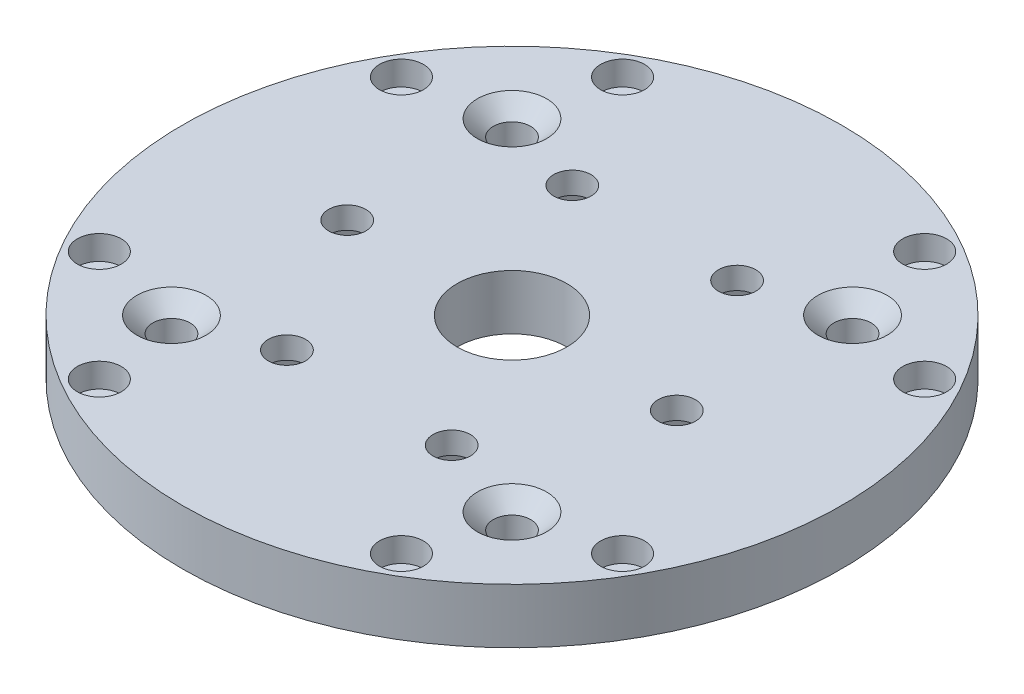
from build123d import *

# Parameters (mm, degrees)
SKETCH1_R                                       = 30
BOSS_EXTRUDE1_DEPTH                             = 5
CSK_FOR_M3_FLAT_HEAD_MACHINE_SCREW1_D           = 3.4
CSK_FOR_M3_FLAT_HEAD_MACHINE_SCREW1_CSINK_D     = 6.3
CSK_FOR_M3_FLAT_HEAD_MACHINE_SCREW1_CSINK_ANGLE = 90
CUT_EXTRUDE1_REACH                              = 44.72
SKETCH4_R                                       = 1.1
CUT_EXTRUDE2_REACH                              = 44.72
SKETCH5_R                                       = 5
SKETCH7_R                                       = 2
CUT_EXTRUDE3_DEPTH                              = 2.2
CUT_EXTRUDE4_DEPTH                              = 3
SKETCH9_R                                       = 1.7
CUT_EXTRUDE5_DEPTH                              = 43.720018727


with BuildPart() as part:
    # Sketch1 → Boss-Extrude1 (new body)
    with BuildSketch(Plane(origin=(0, 0, 0), x_dir=(1, 0, 0), z_dir=(0, 1, 0))):
        with Locations(Location((0, 0, 0), (0, 0, 270))):
            Circle(SKETCH1_R)
    extrude(amount=BOSS_EXTRUDE1_DEPTH)

    # CSK for M3 Flat Head Machine Screw1 (through all)
    with Locations(Plane(origin=(0, 5, 0), x_dir=(1, 0, 0), z_dir=(0, 1, 0))):
        with Locations((-15.5, -15.5), (15.5, 15.5), (-15.5, 15.5), (15.5, -15.5)):
            CounterSinkHole(CSK_FOR_M3_FLAT_HEAD_MACHINE_SCREW1_D / 2, CSK_FOR_M3_FLAT_HEAD_MACHINE_SCREW1_CSINK_D / 2, counter_sink_angle=CSK_FOR_M3_FLAT_HEAD_MACHINE_SCREW1_CSINK_ANGLE)

    # Sketch4 → Cut-Extrude1 (cut, up to next)
    with BuildSketch(Plane(origin=(0, 5, 0), x_dir=(1, 0, 0), z_dir=(0, 1, 0)), mode=Mode.PRIVATE) as cut_extrude1_sk1:
        with Locations(Location((-13.75, 23.815698604, 0), (0, 0, 270))):
            Circle(SKETCH4_R)
    cut_extrude1_tool1 = extrude(cut_extrude1_sk1.sketch, amount=-CUT_EXTRUDE1_REACH, mode=Mode.PRIVATE) & part.part
    # Sketch4 → Cut-Extrude1 (cut, up to next)
    with BuildSketch(Plane(origin=(0, 5, 0), x_dir=(1, 0, 0), z_dir=(0, 1, 0)), mode=Mode.PRIVATE) as cut_extrude1_sk2:
        with Locations(Location((-23.815698604, 13.75, 0), (0, 0, 270))):
            Circle(SKETCH4_R)
    cut_extrude1_tool2 = extrude(cut_extrude1_sk2.sketch, amount=-CUT_EXTRUDE1_REACH, mode=Mode.PRIVATE) & part.part
    # Sketch4 → Cut-Extrude1 (cut, up to next)
    with BuildSketch(Plane(origin=(0, 5, 0), x_dir=(1, 0, 0), z_dir=(0, 1, 0)), mode=Mode.PRIVATE) as cut_extrude1_sk3:
        with Locations(Location((13.75, 23.815698604, 0), (0, 0, 270))):
            Circle(SKETCH4_R)
    cut_extrude1_tool3 = extrude(cut_extrude1_sk3.sketch, amount=-CUT_EXTRUDE1_REACH, mode=Mode.PRIVATE) & part.part
    # Sketch4 → Cut-Extrude1 (cut, up to next)
    with BuildSketch(Plane(origin=(0, 5, 0), x_dir=(1, 0, 0), z_dir=(0, 1, 0)), mode=Mode.PRIVATE) as cut_extrude1_sk4:
        with Locations(Location((23.815698604, 13.75, 0), (0, 0, 270))):
            Circle(SKETCH4_R)
    cut_extrude1_tool4 = extrude(cut_extrude1_sk4.sketch, amount=-CUT_EXTRUDE1_REACH, mode=Mode.PRIVATE) & part.part
    # Sketch4 → Cut-Extrude1 (cut, up to next)
    with BuildSketch(Plane(origin=(0, 5, 0), x_dir=(1, 0, 0), z_dir=(0, 1, 0)), mode=Mode.PRIVATE) as cut_extrude1_sk5:
        with Locations(Location((23.815698604, -13.75, 0), (0, 0, 270))):
            Circle(SKETCH4_R)
    cut_extrude1_tool5 = extrude(cut_extrude1_sk5.sketch, amount=-CUT_EXTRUDE1_REACH, mode=Mode.PRIVATE) & part.part
    # Sketch4 → Cut-Extrude1 (cut, up to next)
    with BuildSketch(Plane(origin=(0, 5, 0), x_dir=(1, 0, 0), z_dir=(0, 1, 0)), mode=Mode.PRIVATE) as cut_extrude1_sk6:
        with Locations(Location((13.75, -23.815698604, 0), (0, 0, 270))):
            Circle(SKETCH4_R)
    cut_extrude1_tool6 = extrude(cut_extrude1_sk6.sketch, amount=-CUT_EXTRUDE1_REACH, mode=Mode.PRIVATE) & part.part
    # Sketch4 → Cut-Extrude1 (cut, up to next)
    with BuildSketch(Plane(origin=(0, 5, 0), x_dir=(1, 0, 0), z_dir=(0, 1, 0)), mode=Mode.PRIVATE) as cut_extrude1_sk7:
        with Locations(Location((-13.75, -23.815698604, 0), (0, 0, 270))):
            Circle(SKETCH4_R)
    cut_extrude1_tool7 = extrude(cut_extrude1_sk7.sketch, amount=-CUT_EXTRUDE1_REACH, mode=Mode.PRIVATE) & part.part
    # Sketch4 → Cut-Extrude1 (cut, up to next)
    with BuildSketch(Plane(origin=(0, 5, 0), x_dir=(1, 0, 0), z_dir=(0, 1, 0)), mode=Mode.PRIVATE) as cut_extrude1_sk8:
        with Locations(Location((-23.815698604, -13.75, 0), (0, 0, 270))):
            Circle(SKETCH4_R)
    cut_extrude1_tool8 = extrude(cut_extrude1_sk8.sketch, amount=-CUT_EXTRUDE1_REACH, mode=Mode.PRIVATE) & part.part
    add(cut_extrude1_tool1.solids().sort_by_distance((-13.75, 5, -23.815699))[0], mode=Mode.SUBTRACT)
    add(cut_extrude1_tool2.solids().sort_by_distance((-23.815699, 5, -13.75))[0], mode=Mode.SUBTRACT)
    add(cut_extrude1_tool3.solids().sort_by_distance((13.75, 5, -23.815699))[0], mode=Mode.SUBTRACT)
    add(cut_extrude1_tool4.solids().sort_by_distance((23.815699, 5, -13.75))[0], mode=Mode.SUBTRACT)
    add(cut_extrude1_tool5.solids().sort_by_distance((23.815699, 5, 13.75))[0], mode=Mode.SUBTRACT)
    add(cut_extrude1_tool6.solids().sort_by_distance((13.75, 5, 23.815699))[0], mode=Mode.SUBTRACT)
    add(cut_extrude1_tool7.solids().sort_by_distance((-13.75, 5, 23.815699))[0], mode=Mode.SUBTRACT)
    add(cut_extrude1_tool8.solids().sort_by_distance((-23.815699, 5, 13.75))[0], mode=Mode.SUBTRACT)

    # Sketch5 → Cut-Extrude2 (cut, up to next)
    with BuildSketch(Plane(origin=(0, 5, 0), x_dir=(1, 0, 0), z_dir=(0, 1, 0)), mode=Mode.PRIVATE) as cut_extrude2_sk1:
        with Locations(Location((0, 0, 0), (0, 0, 270))):
            Circle(SKETCH5_R)
    cut_extrude2_tool1 = extrude(cut_extrude2_sk1.sketch, amount=-CUT_EXTRUDE2_REACH, mode=Mode.PRIVATE) & part.part
    add(cut_extrude2_tool1.solids().sort_by_distance((0, 5, 0))[0], mode=Mode.SUBTRACT)

    # Sketch7 → Cut-Extrude3 (cut)
    with BuildSketch(Plane(origin=(0, 5, 0), x_dir=(1, 0, 0), z_dir=(0, 1, 0))):
        with Locations(Location((-13.75, 23.815698604, 0), (0, 0, 270))):
            Circle(SKETCH7_R)
        with Locations(Location((-23.815698604, 13.75, 0), (0, 0, 270))):
            Circle(SKETCH7_R)
        with Locations(Location((13.75, 23.815698604, 0), (0, 0, 270))):
            Circle(SKETCH7_R)
        with Locations(Location((23.815698604, 13.75, 0), (0, 0, 270))):
            Circle(SKETCH7_R)
        with Locations(Location((23.815698604, -13.75, 0), (0, 0, 270))):
            Circle(SKETCH7_R)
        with Locations(Location((13.75, -23.815698604, 0), (0, 0, 270))):
            Circle(SKETCH7_R)
        with Locations(Location((-13.75, -23.815698604, 0), (0, 0, 270))):
            Circle(SKETCH7_R)
        with Locations(Location((-23.815698604, -13.75, 0), (0, 0, 270))):
            Circle(SKETCH7_R)
    extrude(amount=-CUT_EXTRUDE3_DEPTH, mode=Mode.SUBTRACT)

    # Sketch8 → Cut-Extrude4 (cut)
    with BuildSketch(Plane(origin=(0, 0, 0), x_dir=(1, 0, 0), z_dir=(0, 1, 0))):
        Polygon((-9.08771324, 15.740381057), (-10.675426481, 12.990381057), (-9.08771324, 10.240381057), (-5.91228676, 10.240381057), (-4.324573519, 12.990381057), (-5.91228676, 15.740381057), align=None)
        Polygon((-18.175426481, 0), (-16.58771324, -2.75), (-13.41228676, -2.75), (-11.824573519, 0), (-13.41228676, 2.75), (-16.58771324, 2.75), align=None)
        Polygon((9.08771324, 15.740381057), (5.91228676, 15.740381057), (4.324573519, 12.990381057), (5.91228676, 10.240381057), (9.08771324, 10.240381057), (10.675426481, 12.990381057), align=None)
        Polygon((18.175426481, 0), (16.58771324, 2.75), (13.41228676, 2.75), (11.824573519, 0), (13.41228676, -2.75), (16.58771324, -2.75), align=None)
        Polygon((9.08771324, -15.740381057), (10.675426481, -12.990381057), (9.08771324, -10.240381057), (5.91228676, -10.240381057), (4.324573519, -12.990381057), (5.91228676, -15.740381057), align=None)
        Polygon((-9.08771324, -15.740381057), (-5.91228676, -15.740381057), (-4.324573519, -12.990381057), (-5.91228676, -10.240381057), (-9.08771324, -10.240381057), (-10.675426481, -12.990381057), align=None)
    extrude(amount=CUT_EXTRUDE4_DEPTH, mode=Mode.SUBTRACT)

    # Sketch9 → Cut-Extrude5 (cut, through all)
    with BuildSketch(Plane.XZ):
        with Locations(Location((15, 0, 0), (0, 0, 270))):
            Circle(SKETCH9_R)
        with Locations(Location((7.5, -12.990381057, 0), (0, 0, 270))):
            Circle(SKETCH9_R)
        with Locations(Location((-7.5, -12.990381057, 0), (0, 0, 270))):
            Circle(SKETCH9_R)
        with Locations(Location((-15, 0, 0), (0, 0, 270))):
            Circle(SKETCH9_R)
        with Locations(Location((-7.5, 12.990381057, 0), (0, 0, 270))):
            Circle(SKETCH9_R)
        with Locations(Location((7.5, 12.990381057, 0), (0, 0, 270))):
            Circle(SKETCH9_R)
    extrude(amount=-CUT_EXTRUDE5_DEPTH, mode=Mode.SUBTRACT)


solid = part.part
